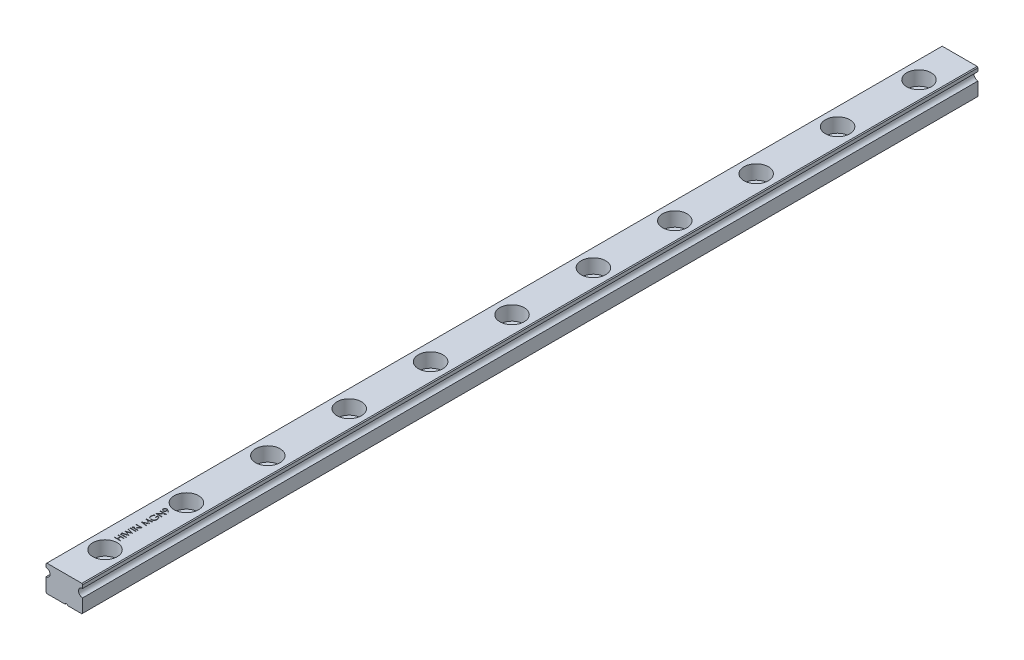
from build123d import *

# Parameters (mm, degrees)
EXTRUDE_1_DEPTH              = 220
HOLE_WIZARD_M3_1_D           = 3.5
HOLE_WIZARD_M3_1_CBORE_D     = 6
HOLE_WIZARD_M3_1_CBORE_DEPTH = 3.5
PATTERN_LINEAR_1_COUNT       = 11
PATTERN_LINEAR_1_PITCH       = 20
SKETCH_6_W                   = 1.5
SKETCH_6_H                   = 0.134615385
CUT_EXTRUDE_1_DEPTH          = 0.1


with BuildPart() as part:
    # 草图1 → 凸台-拉伸1 (new body)
    with BuildSketch(Plane.XY):
        with BuildLine():
            Line((4.5, 5.5), (4.5, 6.3))
            Line((4.5, 6.3), (4.3, 6.5))
            Line((4.3, 6.5), (-4.3, 6.5))
            Line((-4.3, 6.5), (-4.5, 6.3))
            Line((-4.5, 6.3), (-4.5, 5.5))
            ThreePointArc((-4.5, 5.5), (-3.5, 4.5), (-4.5, 3.5))
            Line((-4.5, 3.5), (-4.5, 0.2))
            Line((-4.5, 0.2), (-4.3, 0))
            Line((-4.3, 0), (0.2, 0))
            ThreePointArc((0.2, 0), (0.5, 0.3), (0.8, 0))
            Line((0.8, 0), (4.3, 0))
            Line((4.3, 0), (4.5, 0.2))
            Line((4.5, 0.2), (4.5, 3.5))
            ThreePointArc((4.5, 3.5), (3.5, 4.5), (4.5, 5.5))
        make_face()
    extrude(amount=-EXTRUDE_1_DEPTH)

    # M3 六角凹头螺钉的柱形沉头孔1 (through all)
    with Locations(Plane(origin=(0.754900713, 6.5, 19.343475793), x_dir=(-1, 0, 0), z_dir=(0, 1, 0))):
        with Locations((0.754900713, -29.343475793)):
            hole_wizard_m3_1 = CounterBoreHole(HOLE_WIZARD_M3_1_D / 2, HOLE_WIZARD_M3_1_CBORE_D / 2, HOLE_WIZARD_M3_1_CBORE_DEPTH)

    # 阵列(线性)1: M3 六角凹头螺钉的柱形沉头孔1 ×11
    with Locations(*[(0, 0, -i * PATTERN_LINEAR_1_PITCH) for i in range(1, PATTERN_LINEAR_1_COUNT)]):
        add(hole_wizard_m3_1, mode=Mode.SUBTRACT)

    # 草图6 → 切除-拉伸1 (cut)
    # profile 1 of 9: a face of its own
    with BuildSketch(Plane(origin=(0, 6.5, 0), x_dir=(1, 0, 0), z_dir=(0, 1, 0))):
        Polygon((-1.5, 13.740384615), (-1.5, 13.875), (-0.884615385, 13.875), (-0.884615385, 14.644230769), (-1.5, 14.644230769), (-1.5, 14.778846154), (0, 14.778846154), (0, 14.644230769), (-0.730769231, 14.644230769), (-0.730769231, 13.875), (0, 13.875), (0, 13.740384615), align=None)
    # profile 2 of 9: a face of its own
    with BuildSketch(Plane(origin=(0, 6.5, 0), x_dir=(1, 0, 0), z_dir=(0, 1, 0))):
        with Locations((-0.75, 15.230769231)):
            Rectangle(SKETCH_6_W, SKETCH_6_H)
    # profile 3 of 9: a face of its own
    with BuildSketch(Plane(origin=(0, 6.5, 0), x_dir=(1, 0, 0), z_dir=(0, 1, 0))):
        Polygon((-1.5, 15.528846154), (-1.5, 15.66796875), (-0.399939904, 15.961538462), (-1.5, 16.398137019), (-1.5, 16.417668269), (-0.407451923, 16.846153846), (-1.5, 17.141225962), (-1.5, 17.278846154), (0, 16.874399038), (0, 16.855168269), (-1.147235577, 16.403846154), (0, 15.947115385), (0, 15.927884615), align=None)
    # profile 4 of 9: a face of its own
    with BuildSketch(Plane(origin=(0, 6.5, 0), x_dir=(1, 0, 0), z_dir=(0, 1, 0))):
        with Locations((-0.75, 17.692307693)):
            Rectangle(SKETCH_6_W, SKETCH_6_H)
    # profile 5 of 9: a face of its own
    with BuildSketch(Plane(origin=(0, 6.5, 0), x_dir=(1, 0, 0), z_dir=(0, 1, 0))):
        Polygon((0, 18.086538462), (-1.5, 18.086538462), (-1.5, 18.114783654), (-0.319411058, 19.105769231), (-1.5, 19.105769231), (-1.5, 19.240384615), (0, 19.240384615), (0, 19.209735577), (-1.177884615, 18.221153846), (0, 18.221153846), align=None)
    # profile 6 of 9: a face of its own
    with BuildSketch(Plane(origin=(0, 6.5, 0), x_dir=(1, 0, 0), z_dir=(0, 1, 0))):
        Polygon((0, 20.125), (-1.5, 20.323016827), (-1.5, 20.342247596), (-0.269230769, 20.961538462), (-1.5, 21.579326923), (-1.5, 21.598858173), (0, 21.798076923), (0, 21.662860577), (-1.079326923, 21.519230769), (0, 20.977764423), (0, 20.947415865), (-1.081730769, 20.403846154), (0, 20.260516827), align=None)
    # profile 7 of 9: a face of its own
    with BuildSketch(Plane(origin=(0, 6.5, 0), x_dir=(1, 0, 0), z_dir=(0, 1, 0))):
        with BuildLine():
            Line((-1.243990385, 23.509615385), (-1.134615385, 23.394230769))
            add(Edge.make_bspline(
                [(-1.134615385, 23.394230769), (-1.154263766, 23.373355449), (-1.193092001, 23.332102593), (-1.243390317, 23.264731189), (-1.28690443, 23.194721537), (-1.322045397, 23.121960438), (-1.349611823, 23.048355866), (-1.369650093, 22.975173457), (-1.382340162, 22.902887044), (-1.383864341, 22.854816629), (-1.384615385, 22.831129808)],
                knots=[0, 0, 0, 0, 1.089067066, 2.152164705, 3.18986567, 4.218445106, 5.218487318, 6.173592265, 7.100032889, 8, 8, 8, 8], degree=3))
            add(Edge.make_bspline(
                [(-1.384615385, 22.831129808), (-1.384438125, 22.816594936), (-1.384084065, 22.78756289), (-1.379565116, 22.7444392), (-1.373065889, 22.701767784), (-1.363662227, 22.659629195), (-1.351744059, 22.6179415), (-1.336836002, 22.576849691), (-1.319455188, 22.536277104), (-1.299371251, 22.496605953), (-1.277308532, 22.458145638), (-1.252858892, 22.42182164), (-1.226807524, 22.387400299), (-1.198496406, 22.355536353), (-1.168203133, 22.326017847), (-1.136473262, 22.298301833), (-1.102682945, 22.272904871), (-1.066971137, 22.250282454), (-1.030168657, 22.229853485), (-0.992587626, 22.212199685), (-0.954576919, 22.196852561), (-0.915850319, 22.185163721), (-0.876807084, 22.175263346), (-0.837242608, 22.168371388), (-0.797053572, 22.164472967), (-0.770140273, 22.163799899), (-0.756610577, 22.163461538)],
                knots=[0, 0, 0, 0, 1.028150113, 2.053633673, 3.06513288, 4.081487945, 5.106702018, 6.131327874, 7.172780699, 8.228344599, 9.276313556, 10.308389736, 11.324843658, 12.329040066, 13.321460474, 14.316307835, 15.308626991, 16.309440696, 17.305625405, 18.28535951, 19.246194545, 20.203493668, 21.145557131, 22.095268976, 23.042464743, 24, 24, 24, 24], degree=3))
            add(Edge.make_bspline(
                [(-0.756610577, 22.163461538), (-0.742780294, 22.163785622), (-0.715157493, 22.164432905), (-0.673930463, 22.168569989), (-0.633320499, 22.176265079), (-0.593263727, 22.186470115), (-0.553680426, 22.199444118), (-0.514611904, 22.215383767), (-0.476061961, 22.23437211), (-0.438413282, 22.256302653), (-0.401770368, 22.280520997), (-0.36696502, 22.307157219), (-0.334402283, 22.336256163), (-0.303606537, 22.367284281), (-0.274772132, 22.40052428), (-0.248246624, 22.43629865), (-0.223619847, 22.474106619), (-0.201162346, 22.513964957), (-0.181102046, 22.555452377), (-0.163263098, 22.597990847), (-0.14857199, 22.641717091), (-0.136598507, 22.686401091), (-0.126784097, 22.731989638), (-0.120470176, 22.778714125), (-0.115888391, 22.826231), (-0.11555339, 22.858261842), (-0.115384615, 22.874399038)],
                knots=[0, 0, 0, 0, 0.935915162, 1.869274651, 2.799799983, 3.730201895, 4.664668062, 5.616159355, 6.583070886, 7.570012957, 8.562524459, 9.553461134, 10.53281078, 11.515274572, 12.509912756, 13.507571325, 14.526460018, 15.561318395, 16.601025881, 17.643204557, 18.680545676, 19.719612342, 20.772381578, 21.833430283, 22.908478249, 24, 24, 24, 24], degree=3))
            add(Edge.make_bspline(
                [(-0.115384615, 22.874399038), (-0.11579098, 22.893846981), (-0.116588941, 22.932036175), (-0.122805743, 22.988172098), (-0.132502802, 23.042091792), (-0.14674811, 23.093619722), (-0.164779159, 23.142942891), (-0.187077122, 23.189879386), (-0.213407387, 23.234558812), (-0.24323677, 23.276787781), (-0.276471827, 23.315562361), (-0.312015273, 23.350851823), (-0.350327601, 23.381442662), (-0.390837822, 23.408248655), (-0.433933425, 23.430404616), (-0.479374666, 23.448595707), (-0.527189663, 23.462538188), (-0.560228886, 23.468261798), (-0.576923077, 23.471153846)],
                knots=[0, 0, 0, 0, 1.130199668, 2.219330667, 3.279027493, 4.311506524, 5.322739849, 6.327972234, 7.327472899, 8.33386792, 9.329086447, 10.29244429, 11.240784345, 12.174119183, 13.111530729, 14.052100829, 15.015757696, 16, 16, 16, 16], degree=3))
            Line((-0.576923077, 23.471153846), (-0.576923077, 22.971153846))
            Line((-0.576923077, 22.971153846), (-0.730769231, 22.971153846))
            Line((-0.730769231, 22.971153846), (-0.730769231, 23.605769231))
            add(Edge.make_bspline(
                [(-0.730769231, 23.605769231), (-0.702094593, 23.605038153), (-0.645973146, 23.603607301), (-0.564128744, 23.593570623), (-0.48682659, 23.577363547), (-0.413985274, 23.555223413), (-0.34570802, 23.526562579), (-0.281925506, 23.491688638), (-0.223049785, 23.450043443), (-0.168600212, 23.403110397), (-0.12003055, 23.350438986), (-0.077342291, 23.293452435), (-0.041384027, 23.232056591), (-0.012129457, 23.166309531), (0.010702255, 23.096426488), (0.026890073, 23.022245754), (0.036588629, 22.943867925), (0.037827792, 22.890152206), (0.038461538, 22.862680288)],
                knots=[0, 0, 0, 0, 1.140356446, 2.231883559, 3.274166699, 4.278491846, 5.25512956, 6.21435461, 7.1637429, 8.11826594, 9.068280886, 10.0076534, 10.945064095, 11.891975133, 12.864533718, 13.863980011, 14.907571808, 16, 16, 16, 16], degree=3))
            add(Edge.make_bspline(
                [(0.038461538, 22.862680288), (0.038217629, 22.845747373), (0.037736562, 22.812350207), (0.034317699, 22.763025524), (0.029054595, 22.715060829), (0.021106685, 22.668463111), (0.011371833, 22.623060964), (-0.001093904, 22.579081142), (-0.015523346, 22.53635611), (-0.031935778, 22.494819831), (-0.050952202, 22.45484931), (-0.072084905, 22.416266517), (-0.095224917, 22.378858178), (-0.120772422, 22.342879107), (-0.148536333, 22.308141841), (-0.178572299, 22.274870365), (-0.210788493, 22.242878417), (-0.233665211, 22.222838219), (-0.245192308, 22.212740385)],
                knots=[0, 0, 0, 0, 1.107784379, 2.184907829, 3.233506516, 4.263428166, 5.276301166, 6.270063455, 7.25232949, 8.225834625, 9.190232166, 10.146266622, 11.1027726, 12.066435141, 13.031522626, 14.010570082, 14.99756817, 16, 16, 16, 16], degree=3))
            add(Edge.make_bspline(
                [(-0.245192308, 22.212740385), (-0.26347973, 22.198089271), (-0.299751023, 22.169030237), (-0.357865285, 22.131625313), (-0.418037511, 22.099738997), (-0.480435209, 22.073867073), (-0.545000015, 22.053665036), (-0.611649425, 22.039176642), (-0.680469267, 22.030687804), (-0.727040094, 22.02946486), (-0.750600962, 22.028846154)],
                knots=[0, 0, 0, 0, 1.023165419, 2.029347347, 3.013907458, 3.994755782, 4.975994455, 5.96558838, 6.970761222, 8, 8, 8, 8], degree=3))
            add(Edge.make_bspline(
                [(-0.750600962, 22.028846154), (-0.768243641, 22.029074256), (-0.803304773, 22.029527561), (-0.855357904, 22.035024211), (-0.906486775, 22.042910531), (-0.956649576, 22.054502135), (-1.005879862, 22.069114786), (-1.054200296, 22.087352121), (-1.101640133, 22.108585168), (-1.147870041, 22.133266476), (-1.192287019, 22.160724506), (-1.234673706, 22.190556358), (-1.274343142, 22.222992223), (-1.311387223, 22.258126549), (-1.346354989, 22.295251091), (-1.378516018, 22.33514522), (-1.408373576, 22.377204507), (-1.435353952, 22.421754996), (-1.459597318, 22.468093695), (-1.480849352, 22.516119874), (-1.498413761, 22.565816082), (-1.513316774, 22.616810749), (-1.524337558, 22.669489669), (-1.532329875, 22.723470616), (-1.537798704, 22.779034949), (-1.538238528, 22.816593247), (-1.538461538, 22.835637019)],
                knots=[0, 0, 0, 0, 1.00895651, 2.005089799, 2.991467152, 3.967318338, 4.948153826, 5.927364234, 6.919980553, 7.91976625, 8.923240147, 9.905815003, 10.88314567, 11.851989312, 12.825009789, 13.798721852, 14.781296708, 15.773896486, 16.776076962, 17.771600213, 18.775744723, 19.78957137, 20.808953803, 21.851964491, 22.910847925, 24, 24, 24, 24], degree=3))
            add(Edge.make_bspline(
                [(-1.538461538, 22.835637019), (-1.538213185, 22.851167695), (-1.537720729, 22.8819632), (-1.534307308, 22.927788514), (-1.528897073, 22.97290552), (-1.521514165, 23.017381116), (-1.511458298, 23.061063844), (-1.499424747, 23.104078147), (-1.485413966, 23.146486377), (-1.46870446, 23.188155626), (-1.449738621, 23.229366076), (-1.428390011, 23.270346865), (-1.404293581, 23.31095797), (-1.37737778, 23.351269819), (-1.348104887, 23.391536616), (-1.315637676, 23.431121462), (-1.281256495, 23.470979867), (-1.256535559, 23.496609216), (-1.243990385, 23.509615385)],
                knots=[0, 0, 0, 0, 0.985871117, 1.954866573, 2.915460327, 3.869826059, 4.81536089, 5.759505086, 6.70452669, 7.649098992, 8.607881297, 9.583363685, 10.581137262, 11.603961102, 12.659522466, 13.73993555, 14.853081303, 16, 16, 16, 16], degree=3))
        make_face()
    # profile 8 of 9: a face of its own
    with BuildSketch(Plane(origin=(0, 6.5, 0), x_dir=(1, 0, 0), z_dir=(0, 1, 0))):
        Polygon((0, 23.913461538), (-1.5, 23.913461538), (-1.5, 23.941706731), (-0.319411058, 24.932692308), (-1.5, 24.932692308), (-1.5, 25.067307692), (0, 25.067307692), (0, 25.036658654), (-1.177884615, 24.048076923), (0, 24.048076923), align=None)
    # profile 9 of 9: a face of its own
    with BuildSketch(Plane(origin=(0, 6.5, 0), x_dir=(1, 0, 0), z_dir=(0, 1, 0))):
        with BuildLine():
            Line((0.038461538, 25.644230769), (-0.036358173, 25.536658654))
            Line((-0.036358173, 25.536658654), (-0.646033654, 25.953725962))
            add(Edge.make_bspline(
                [(-0.646033654, 25.953725962), (-0.642627639, 25.927119325), (-0.635922786, 25.874743285), (-0.635046516, 25.821948826), (-0.634615385, 25.795973558)],
                knots=[0, 0, 0, 0, 1.015985029, 2, 2, 2, 2], degree=3))
            add(Edge.make_bspline(
                [(-0.634615385, 25.795973558), (-0.635018703, 25.780226966), (-0.635810382, 25.749317783), (-0.642085443, 25.703875646), (-0.651749784, 25.660210407), (-0.666170676, 25.61843782), (-0.684092777, 25.578400913), (-0.706317169, 25.540186946), (-0.732462883, 25.503847908), (-0.762390698, 25.469771994), (-0.79525498, 25.438786105), (-0.830027824, 25.411158608), (-0.867084601, 25.38832306), (-0.905643777, 25.369014905), (-0.946528356, 25.354782526), (-0.989044603, 25.344167996), (-1.033456433, 25.33770465), (-1.063680548, 25.336931181), (-1.079026442, 25.336538462)],
                knots=[0, 0, 0, 0, 1.060698949, 2.082059282, 3.085738422, 4.069684654, 5.054463875, 6.037298355, 7.043153692, 8.066652628, 9.088369706, 10.083456696, 11.053578809, 12.016466116, 12.983507685, 13.964045196, 14.966270913, 16, 16, 16, 16], degree=3))
            add(Edge.make_bspline(
                [(-1.079026442, 25.336538462), (-1.100012199, 25.337283285), (-1.141202981, 25.338745222), (-1.201400397, 25.350466182), (-1.258351131, 25.369885651), (-1.3119915, 25.396537862), (-1.361089385, 25.43075081), (-1.405478439, 25.47138122), (-1.444366827, 25.518757479), (-1.477757084, 25.571642671), (-1.504794475, 25.628718475), (-1.524003389, 25.688742519), (-1.536274492, 25.750703662), (-1.537729379, 25.792811829), (-1.538461538, 25.814002404)],
                knots=[0, 0, 0, 0, 1.023011052, 2.007963168, 2.978169221, 3.950402619, 4.919353283, 5.887490769, 6.876420893, 7.899700203, 8.931203047, 9.947778163, 10.96723692, 12, 12, 12, 12], degree=3))
            add(Edge.make_bspline(
                [(-1.538461538, 25.814002404), (-1.537677179, 25.834783148), (-1.536127357, 25.875843941), (-1.524777147, 25.936225043), (-1.505646911, 25.994056533), (-1.479211547, 26.04902008), (-1.446070758, 26.099903164), (-1.406596454, 26.145683388), (-1.360755672, 26.185145911), (-1.309807647, 26.21879079), (-1.25472961, 26.245295182), (-1.197347446, 26.264716171), (-1.138006313, 26.276587527), (-1.097810064, 26.2780886), (-1.077524038, 26.278846154)],
                knots=[0, 0, 0, 0, 1.026358223, 2.027987109, 3.023239252, 4.028077889, 5.032770297, 6.015020143, 7.004250571, 8.011656937, 9.02310243, 10.015224881, 10.998334443, 12, 12, 12, 12], degree=3))
            add(Edge.make_bspline(
                [(-1.077524038, 26.278846154), (-1.061777289, 26.278338872), (-1.029838946, 26.277309978), (-0.981399024, 26.270187018), (-0.932048608, 26.257900384), (-0.890237555, 26.244171772), (-0.855599349, 26.230715419), (-0.828157364, 26.218414328), (-0.799474135, 26.204124912), (-0.769432207, 26.188166246), (-0.737992383, 26.170568563), (-0.705372722, 26.150853478), (-0.671525668, 26.129286907), (-0.648704972, 26.113932306), (-0.637019231, 26.106069712)],
                knots=[0, 0, 0, 0, 1.179894106, 2.393120058, 3.660107319, 4.986885617, 5.687958251, 6.443931318, 7.239444731, 8.088894906, 8.992865148, 9.938946712, 10.944601238, 12, 12, 12, 12], degree=3))
            Line((-0.637019231, 26.106069712), (0.038461538, 25.644230769))
        make_face()
        with BuildLine():
            add(Edge.make_bspline(
                [(-0.788461538, 25.820913462), (-0.788788092, 25.832842038), (-0.789423782, 25.856062922), (-0.793275522, 25.890085737), (-0.800155229, 25.922181807), (-0.809870336, 25.952557703), (-0.822177437, 25.981176653), (-0.837175655, 26.008047671), (-0.855193568, 26.032896281), (-0.875446063, 26.05581095), (-0.897641992, 26.076606708), (-0.92142287, 26.094537445), (-0.946049906, 26.110062218), (-0.972027251, 26.122447516), (-0.998929945, 26.132428799), (-1.027147055, 26.139393389), (-1.056483756, 26.143240028), (-1.076411522, 26.143896939), (-1.086538462, 26.144230769)],
                knots=[0, 0, 0, 0, 1.163726718, 2.265380301, 3.334713825, 4.36057981, 5.371541381, 6.368955992, 7.355979581, 8.359691305, 9.348261197, 10.317521986, 11.261029684, 12.183096459, 13.119698615, 14.055740009, 15.011961376, 16, 16, 16, 16], degree=3))
            add(Edge.make_bspline(
                [(-1.086538462, 26.144230769), (-1.096669885, 26.143944046), (-1.116635099, 26.143379024), (-1.146011565, 26.138837612), (-1.174173238, 26.130870253), (-1.201311834, 26.120071794), (-1.227278993, 26.10611642), (-1.252156559, 26.089207568), (-1.27556797, 26.06878977), (-1.297899065, 26.04597379), (-1.318157147, 26.020878942), (-1.336055672, 25.994290795), (-1.351161049, 25.966351386), (-1.363089133, 25.93693608), (-1.37286104, 25.906444325), (-1.379778661, 25.87456046), (-1.383632614, 25.841240421), (-1.384283622, 25.818619358), (-1.384615385, 25.807091346)],
                knots=[0, 0, 0, 0, 0.971910406, 1.91526867, 2.84337505, 3.775008003, 4.712374136, 5.666733183, 6.654995996, 7.688089235, 8.726800303, 9.745078658, 10.75990398, 11.768337501, 12.786615857, 13.829099629, 14.893678693, 16, 16, 16, 16], degree=3))
            add(Edge.make_bspline(
                [(-1.384615385, 25.807091346), (-1.384283077, 25.795663594), (-1.383631091, 25.773242439), (-1.379786064, 25.740218598), (-1.372814047, 25.708550372), (-1.363093561, 25.678147127), (-1.351160136, 25.648732673), (-1.336054875, 25.620794582), (-1.318161301, 25.594200241), (-1.297882935, 25.569129265), (-1.275672102, 25.546272163), (-1.252051947, 25.526199864), (-1.227292163, 25.509252774), (-1.201308356, 25.495316895), (-1.174174163, 25.48451328), (-1.146011315, 25.476547297), (-1.116635164, 25.472005515), (-1.096669907, 25.471440543), (-1.086538462, 25.471153846)],
                knots=[0, 0, 0, 0, 1.099107991, 2.156440826, 3.191784126, 4.212280276, 5.222910149, 6.239945746, 7.260441896, 8.30141526, 9.33675856, 10.320924759, 11.277362386, 12.216770088, 13.150432123, 14.080559904, 15.025972789, 16, 16, 16, 16], degree=3))
            add(Edge.make_bspline(
                [(-1.086538462, 25.471153846), (-1.076403667, 25.471413811), (-1.056415996, 25.471926509), (-1.02704542, 25.476862927), (-0.998901248, 25.485140198), (-0.971743232, 25.496115903), (-0.945922725, 25.510845615), (-0.921305837, 25.528746476), (-0.897389308, 25.549401013), (-0.875515463, 25.573486122), (-0.855096635, 25.599349364), (-0.837288944, 25.627129241), (-0.822356647, 25.656267501), (-0.809834058, 25.686577057), (-0.800253227, 25.718284705), (-0.793288301, 25.751346293), (-0.789460709, 25.785767775), (-0.788797791, 25.809085836), (-0.788461538, 25.820913462)],
                knots=[0, 0, 0, 0, 0.952872936, 1.879239831, 2.791748947, 3.708674669, 4.628500839, 5.580394867, 6.568761142, 7.595635223, 8.636123962, 9.665976811, 10.694276597, 11.712685318, 12.747011694, 13.805940053, 14.887106426, 16, 16, 16, 16], degree=3))
        make_face(mode=Mode.SUBTRACT)
    extrude(amount=-CUT_EXTRUDE_1_DEPTH, mode=Mode.SUBTRACT)


solid = part.part
